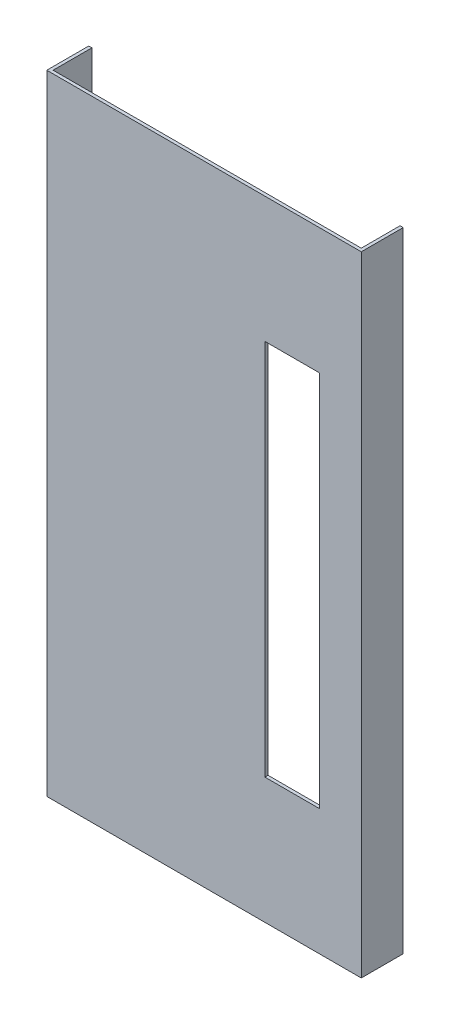
from build123d import *

# Parameters (mm, degrees)
OVEN_YAG_KABI_KAPAGI_KAPAK_1_START = 820
OVEN_YAG_KABI_KAPAGI_KAPAK_1_DEPTH = 300
OVEN_YAG_KABI_KAPAGI_KAPAK_2_START = 27
SKETCH2_W                          = 26
SKETCH2_H                          = 180
OVEN_YAG_KABI_KAPAGI_KAPAK_2_DEPTH = 14


with BuildPart() as part:
    # Sketch1 → OVEN_yag_kabi_kapagi_kapak_1 (new body)
    with BuildSketch(Plane(origin=(0, 0, 0), x_dir=(1, 0, 0), z_dir=(0, 1, 0)).offset(OVEN_YAG_KABI_KAPAGI_KAPAK_1_START)):
        Polygon((30, -40), (30, -20), (31.5, -20), (31.5, -38.5), (178.5, -38.5), (178.5, -20), (180, -20), (180, -40), align=None)
    extrude(amount=OVEN_YAG_KABI_KAPAGI_KAPAK_1_DEPTH)

    # Sketch2 → OVEN_yag_kabi_kapagi_kapak_2 (cut)
    with BuildSketch(Plane.XY.offset(OVEN_YAG_KABI_KAPAGI_KAPAK_2_START)):
        with Locations((147, 970)):
            Rectangle(SKETCH2_W, SKETCH2_H)
    extrude(amount=OVEN_YAG_KABI_KAPAGI_KAPAK_2_DEPTH, mode=Mode.SUBTRACT)


solid = part.part
